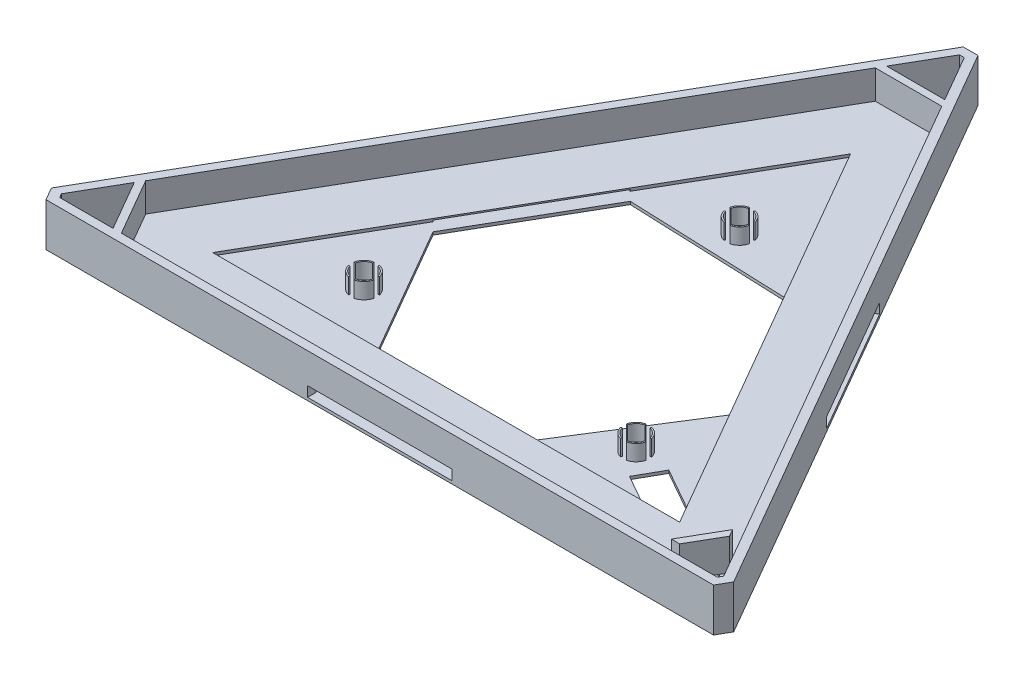
from build123d import *

# Parameters (mm, degrees)
BOSS_EXTRUDE1_DEPTH      = 1
BOSS_EXTRUDE2_DEPTH      = 11
BOSS_EXTRUDE3_DEPTH      = 5
BOSS_EXTRUDE3_DEPTH_BACK = 3
SKETCH3_W                = 50
SKETCH3_H                = 7
CUT_EXTRUDE3_DEPTH       = 25
SKETCH5_W                = 50
SKETCH5_H                = 7
CUT_EXTRUDE4_DEPTH       = 25
SKETCH6_W                = 50
SKETCH6_H                = 7
CUT_EXTRUDE5_DEPTH       = 25
SKETCH8_R                = 1.5
BOSS_EXTRUDE5_DEPTH      = 1
BOSS_EXTRUDE10_DEPTH     = 5.5


with BuildPart() as part:
    # Sketch1 → Boss-Extrude1 (new body)
    with BuildSketch(Plane(origin=(0, 0, 0), x_dir=(1, 0, 0), z_dir=(0, 1, 0))):
        Polygon((243.304219773, -116.484791866), (254.809280576, -136.408896139), (442.602090749, -136.409305398), (444.621046679, -132.925433223), (441.749040748, -132.925433223), (449.516726723, -119.471406457), (450.964695297, -121.978953122), (452.699916621, -118.984688017), (358.778179035, 43.666038066), (335.767496284, 43.666038066), align=None)
        Polygon((428.113670919, -116.417164681), (266.439108268, -116.428009241), (347.273609729, 23.609230825), align=None, mode=Mode.SUBTRACT)
    extrude(amount=BOSS_EXTRUDE1_DEPTH)

    # Sketch1<9> → Boss-Extrude2 (add)
    # profile 1 of 2: a face of its own
    with BuildSketch(Plane(origin=(0, 0, 0), x_dir=(1, 0, 0), z_dir=(0, 1, 0))):
        Polygon((229.159432547, -134.984249184), (231.716666588, -139.412373829), (462.829865412, -139.412373829), (465.38624875, -134.984588004), (349.829542096, 65.165499075), (344.716133219, 65.165499075), align=None)
        Polygon((251.922647988, -136.4093054), (233.446303399, -136.408896139), (232.623553959, -134.984217358), (241.860901688, -118.984688019), align=None, mode=Mode.SUBTRACT)
        Polygon((442.602090749, -136.409305398), (254.809280576, -136.408896139), (243.304219773, -116.484791866), (335.767496284, 43.666038066), (358.778179035, 43.666038066), (461.938967957, -134.984588004), (461.116393748, -136.409305398), align=None, mode=Mode.SUBTRACT)
        Polygon((348.096628302, 62.164013367), (357.334800991, 46.166038067), (337.210874326, 46.166038067), (346.44844193, 62.165948237), align=None, mode=Mode.SUBTRACT)
    # profile 2 of 2: a face of its own
    with BuildSketch(Plane(origin=(0, 0, 0), x_dir=(1, 0, 0), z_dir=(0, 1, 0))):
        Polygon((441.749040748, -132.925433223), (444.621046679, -132.925433223), (450.964695297, -121.978953122), (449.516726723, -119.471406457), align=None)
    extrude(amount=BOSS_EXTRUDE2_DEPTH)

    # Sketch1<10> → Boss-Extrude3 (add, two sides: drawn at the far end of the back side and taken through both)
    with BuildSketch(Plane(origin=(0, 0, 0), x_dir=(1, 0, 0), z_dir=(0, 1, 0)).offset(-BOSS_EXTRUDE3_DEPTH_BACK)):
        Polygon((229.159432547, -134.984249184), (231.716666588, -139.412373829), (462.829865412, -139.412373829), (465.38624875, -134.984588004), (349.829542096, 65.165499075), (344.716133219, 65.165499075), align=None)
        Polygon((251.922647988, -136.4093054), (233.446303399, -136.408896139), (232.623553959, -134.984217358), (241.860901688, -118.984688019), align=None, mode=Mode.SUBTRACT)
        Polygon((442.602090749, -136.409305398), (254.809280576, -136.408896139), (243.304219773, -116.484791866), (335.767496284, 43.666038066), (358.778179035, 43.666038066), (452.699916621, -118.984688017), (461.938967957, -134.984588004), (461.116393748, -136.409305398), align=None, mode=Mode.SUBTRACT)
        Polygon((348.096628302, 62.164013367), (357.334800991, 46.166038067), (337.210874326, 46.166038067), (346.44844193, 62.165948237), align=None, mode=Mode.SUBTRACT)
    extrude(amount=BOSS_EXTRUDE3_DEPTH + BOSS_EXTRUDE3_DEPTH_BACK)

    # Sketch3 → Cut-Extrude3 (cut)
    with BuildSketch(Plane(origin=(290.589645397, 0, -167.772009994), x_dir=(-0.49999999999998745, 0, -0.8660254037844459), z_dir=(0.8660254037844459, 0, -0.49999999999998745))):
        with Locations((-236.592990632, -3)):
            Rectangle(SKETCH3_W, SKETCH3_H)
    extrude(amount=-CUT_EXTRUDE3_DEPTH, mode=Mode.SUBTRACT)

    # Sketch5 → Cut-Extrude4 (cut)
    with BuildSketch(Plane.XY.offset(139.412373829)):
        with Locations((347.273266, -3)):
            Rectangle(SKETCH5_W, SKETCH5_H)
    extrude(amount=-CUT_EXTRUDE4_DEPTH, mode=Mode.SUBTRACT)

    # Sketch6 → Cut-Extrude5 (cut)
    with BuildSketch(Plane(origin=(230.319375797, 0, 132.975171838), x_dir=(-0.5000006154012504, 0, 0.8660250484820695), z_dir=(-0.8660250484820695, 0, -0.5000006154012504))):
        with Locations((-113.2366748, -3)):
            Rectangle(SKETCH6_W, SKETCH6_H)
    extrude(amount=-CUT_EXTRUDE5_DEPTH, mode=Mode.SUBTRACT)

    # Sketch8 → Boss-Extrude5 (add)
    with BuildSketch(Plane.XZ.offset(3)):
        Polygon((349.829542096, -65.165499075), (465.38624875, 134.984588004), (462.829865412, 139.412373829), (231.716666588, 139.412373829), (229.159432547, 134.984249184), (344.716133219, -65.165499075), align=None)
        with Locations((395.323540807, 98.692824234)):
            Circle(SKETCH8_R, mode=Mode.SUBTRACT)
        with Locations((348.301285092, 15.863526629)):
            Circle(SKETCH8_R, mode=Mode.SUBTRACT)
        with Locations((299.654911442, 97.241681781)):
            Circle(SKETCH8_R, mode=Mode.SUBTRACT)
        Polygon((450.14703547, 123.280701064), (452.699916621, 118.984688017), (461.938967957, 134.984588004), (461.116393748, 136.409305398), (442.602090749, 136.409305398), (445.226665069, 131.986443715), (401.697951811, 107.384591709), (406.618322212, 98.678849058), align=None, mode=Mode.SUBTRACT)
        Polygon((322.273266, 116.424264082), (294.358218631, 68.061097964), (319.354499366, 24.757680453), (376.473657317, 26.969372805), (401.47267951, 70.271207531), (372.273266, 116.420910258), align=None, mode=Mode.SUBTRACT)
        Polygon((233.446303399, 136.408896139), (251.922647988, 136.4093054), (241.860901688, 118.984688019), (232.623553959, 134.984217358), align=None, mode=Mode.SUBTRACT)
        Polygon((337.210874326, -46.166038067), (357.334800991, -46.166038067), (348.096628302, -62.164013367), (346.44844193, -62.165948237), align=None, mode=Mode.SUBTRACT)
    extrude(amount=BOSS_EXTRUDE5_DEPTH)

    # Sketch12 → Boss-Extrude10 (add)
    with BuildSketch(Plane(origin=(0, -3, 0), x_dir=(1, 0, 0), z_dir=(0, 1, 0))):
        with BuildLine():
            ThreePointArc((352.69017398, -14.869718639), (351.483265607, -12.681546113), (349.295093082, -11.47463774))
            Line((349.295093082, -11.47463774), (349.184669972, -11.962292061))
            ThreePointArc((349.184669972, -11.962292061), (351.129712216, -13.035099504), (352.202519659, -14.980141749))
            Line((352.202519659, -14.980141749), (352.69017398, -14.869718639))
        make_face()
        with BuildLine():
            Line((347.417900212, -11.962292061), (347.307477102, -11.47463774))
            ThreePointArc((347.307477102, -11.47463774), (345.119304576, -12.681546113), (343.912396203, -14.869718639))
            Line((343.912396203, -14.869718639), (344.400050524, -14.980141749))
            ThreePointArc((344.400050524, -14.980141749), (345.472857967, -13.035099504), (347.417900212, -11.962292061))
        make_face()
        with BuildLine():
            ThreePointArc((349.295093082, -20.252415518), (351.483265607, -19.045507144), (352.69017398, -16.857334619))
            Line((352.69017398, -16.857334619), (352.202519659, -16.746911509))
            ThreePointArc((352.202519659, -16.746911509), (351.129712216, -18.691953754), (349.184669972, -19.764761197))
            Line((349.184669972, -19.764761197), (349.295093082, -20.252415518))
        make_face()
        with BuildLine():
            Line((344.400050524, -16.746911509), (343.912396203, -16.857334619))
            ThreePointArc((343.912396203, -16.857334619), (345.119304576, -19.045507144), (347.307477102, -20.252415518))
            Line((347.307477102, -20.252415518), (347.417900212, -19.764761197))
            ThreePointArc((347.417900212, -19.764761197), (345.472857967, -18.691953754), (344.400050524, -16.746911509))
        make_face()
        with BuildLine():
            Line((394.440155927, -94.791589666), (394.329732817, -94.303935345))
            ThreePointArc((394.329732817, -94.303935345), (392.141560292, -95.510843719), (390.934651919, -97.699016244))
            Line((390.934651919, -97.699016244), (391.4247896, -97.798542945))
            ThreePointArc((391.4247896, -97.798542945), (392.499067689, -95.860448622), (394.440155927, -94.791589666))
        make_face()
        with BuildLine():
            ThreePointArc((399.712429696, -97.699016244), (398.505521323, -95.510843719), (396.317348797, -94.303935345))
            Line((396.317348797, -94.303935345), (396.206925687, -94.791589666))
            ThreePointArc((396.206925687, -94.791589666), (398.151967932, -95.864397109), (399.224775375, -97.809439354))
            Line((399.224775375, -97.809439354), (399.712429696, -97.699016244))
        make_face()
        with BuildLine():
            Line((391.422306239, -99.576209114), (390.934651919, -99.686632224))
            ThreePointArc((390.934651919, -99.686632224), (392.141560292, -101.874804749), (394.329732817, -103.081713123))
            Line((394.329732817, -103.081713123), (394.440155927, -102.594058802))
            ThreePointArc((394.440155927, -102.594058802), (392.495113683, -101.521251359), (391.422306239, -99.576209114))
        make_face()
        with BuildLine():
            ThreePointArc((396.317348797, -103.081713123), (398.505521323, -101.874804749), (399.712429696, -99.686632224))
            Line((399.712429696, -99.686632224), (399.224775375, -99.576209114))
            ThreePointArc((399.224775375, -99.576209114), (398.151967932, -101.521251359), (396.206925687, -102.594058802))
            Line((396.206925687, -102.594058802), (396.317348797, -103.081713123))
        make_face()
        with BuildLine():
            ThreePointArc((298.661103452, -92.852792892), (296.472930927, -94.059701266), (295.266022553, -96.247873791))
            Line((295.266022553, -96.247873791), (295.753676874, -96.358296901))
            ThreePointArc((295.753676874, -96.358296901), (296.826484317, -94.413254657), (298.771526562, -93.340447213))
            Line((298.771526562, -93.340447213), (298.661103452, -92.852792892))
        make_face()
        with BuildLine():
            Line((295.753676874, -98.125066661), (295.266022553, -98.235489771))
            ThreePointArc((295.266022553, -98.235489771), (296.472930927, -100.423662297), (298.661103452, -101.63057067))
            Line((298.661103452, -101.63057067), (298.771526562, -101.142916349))
            ThreePointArc((298.771526562, -101.142916349), (296.826484317, -100.070108906), (295.753676874, -98.125066661))
        make_face()
        with BuildLine():
            ThreePointArc((304.043800331, -96.247873791), (302.836891957, -94.059701266), (300.648719432, -92.852792892))
            Line((300.648719432, -92.852792892), (300.538296322, -93.340447213))
            ThreePointArc((300.538296322, -93.340447213), (302.483338567, -94.413254657), (303.55614601, -96.358296901))
            Line((303.55614601, -96.358296901), (304.043800331, -96.247873791))
        make_face()
        with BuildLine():
            Line((300.538296322, -101.142916349), (300.648719432, -101.63057067))
            ThreePointArc((300.648719432, -101.63057067), (302.836891957, -100.423662297), (304.043800331, -98.235489771))
            Line((304.043800331, -98.235489771), (303.55614601, -98.125066661))
            ThreePointArc((303.55614601, -98.125066661), (302.483338567, -100.070108906), (300.538296322, -101.142916349))
        make_face()
    extrude(amount=BOSS_EXTRUDE10_DEPTH)


solid = part.part
